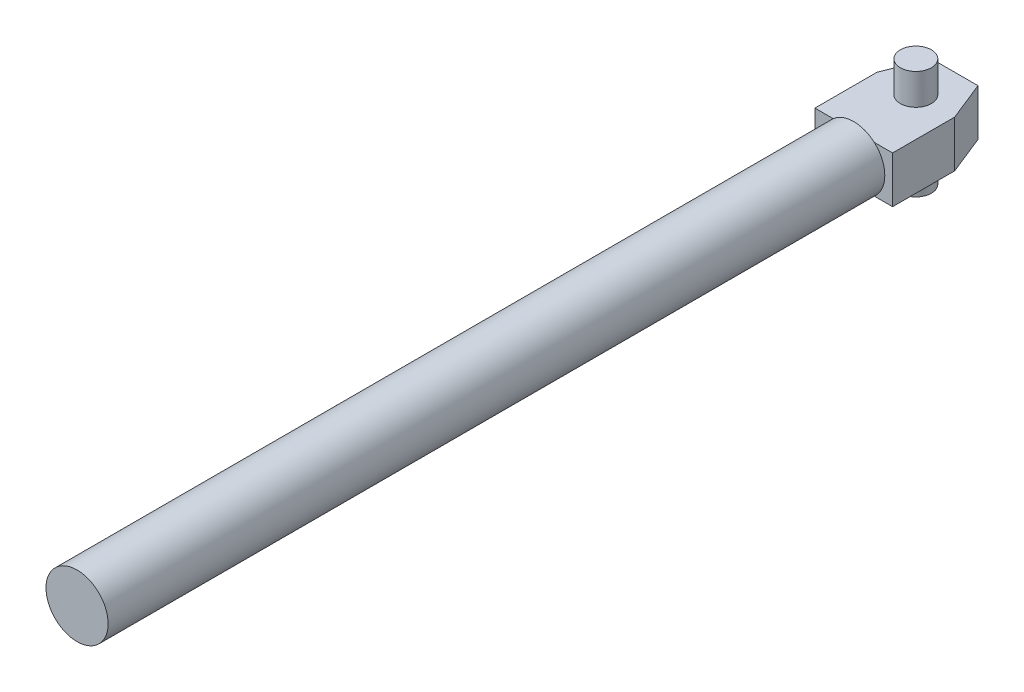
from build123d import *

# Parameters (mm, degrees)
SKETCH1_R                = 20
BOSS_EXTRUDE1_DEPTH      = 500
BOSS_EXTRUDE2_DEPTH      = 15
BOSS_EXTRUDE3_DEPTH      = 35
BOSS_EXTRUDE3_DEPTH_BACK = 35
SKETCH3_R                = 10


with BuildPart() as part:
    # Sketch1 → Boss-Extrude1 (new body)
    with BuildSketch(Plane.XY):
        Circle(SKETCH1_R)
    extrude(amount=BOSS_EXTRUDE1_DEPTH)

    # Sketch2 → Boss-Extrude2 (add, symmetric)
    with BuildSketch(Plane(origin=(0, 0, 0), x_dir=(1, 0, 0), z_dir=(0, 1, 0))):
        Polygon((-25, 0), (25, 0), (25, 40), (15, 65), (-15, 65), (-25, 40), align=None)
    extrude(amount=BOSS_EXTRUDE2_DEPTH, both=True)

    # Sketch3 → Boss-Extrude3 (add, two sides: drawn at the far end of the back side and taken through both)
    with BuildSketch(Plane(origin=(0, 0, 0), x_dir=(1, 0, 0), z_dir=(0, 1, 0)).offset(-BOSS_EXTRUDE3_DEPTH_BACK)):
        with Locations(Location((0, 40, 0), (0, 0, 270))):
            Circle(SKETCH3_R)
    extrude(amount=BOSS_EXTRUDE3_DEPTH + BOSS_EXTRUDE3_DEPTH_BACK)


solid = part.part
